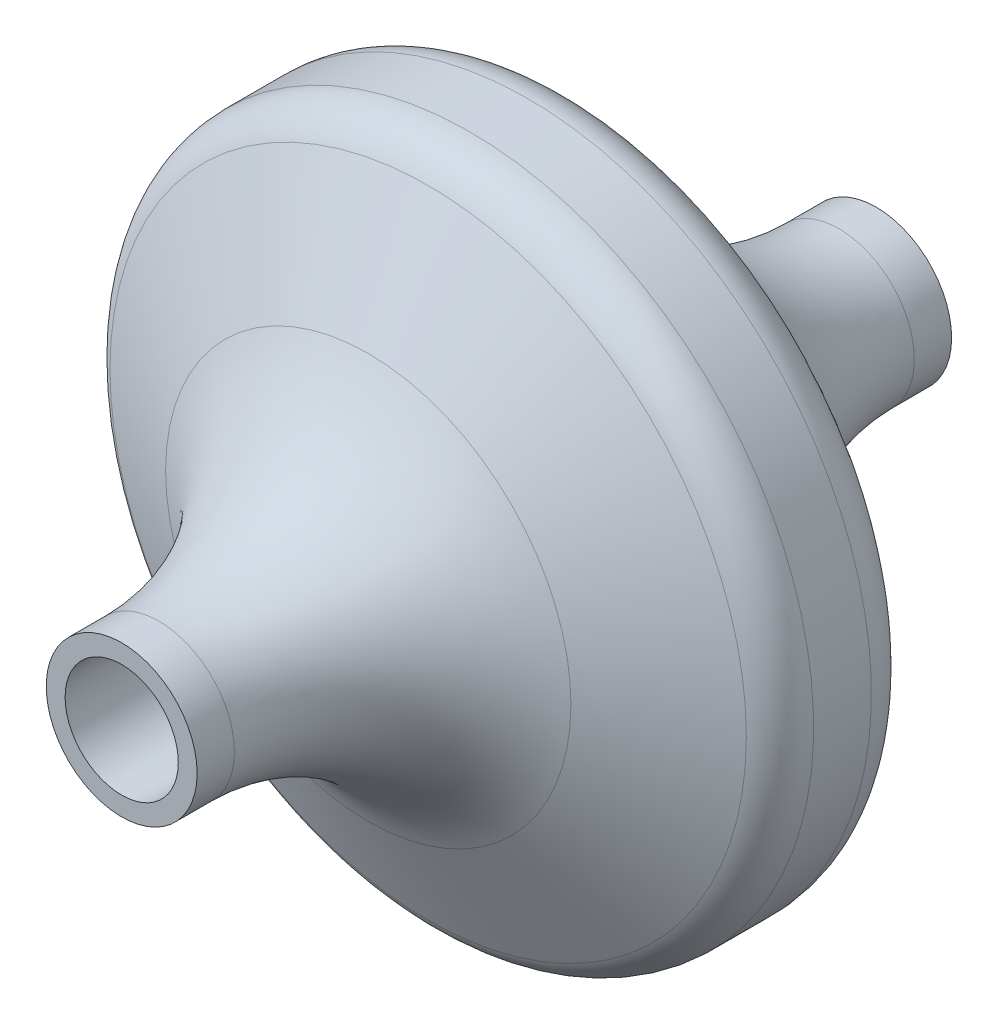
from build123d import *

# Parameters (mm, degrees)
SKETCH1_R           = 8
SKETCH1_R_2         = 6
BOSS_EXTRUDE1_DEPTH = 40
FILLET1_R           = 25


with BuildPart() as part:
    # Sketch1 → Boss-Extrude1 (new, symmetric)
    with BuildSketch(Plane.XY):
        Circle(SKETCH1_R)
        Circle(SKETCH1_R_2, mode=Mode.SUBTRACT)
    extrude(amount=BOSS_EXTRUDE1_DEPTH, both=True)

    # Sketch2 → Revolve1 (revolve)
    with BuildSketch(Plane(origin=(0, 0, 0), x_dir=(0, 0, -1), z_dir=(1, 0, 0)), mode=Mode.PRIVATE) as revolve1_sk:
        with BuildLine():
            Line((-25, 0), (-7.502982863, 33.73728427))
            ThreePointArc((-7.502982863, 33.73728427), (-5.661537285, 35.707899486), (-3.064404332, 36.4353241))
            Line((-3.064404332, 36.4353241), (3.064404332, 36.4353241))
            ThreePointArc((3.064404332, 36.4353241), (5.661537285, 35.707899486), (7.502982863, 33.73728427))
            Line((7.502982863, 33.73728427), (25, 0))
            Line((25, 0), (-25, 0))
        make_face()
    revolve(revolve1_sk.sketch.rotate(Axis((0, 0, -25), (0, 0, 1)), 90), axis=Axis((0, 0, -25), (0, 0, 1)))

    # Fillet1
    fillet1_edges = [part.edges().sort_by_distance(p)[0] for p in [
        (0, 8, -20.850995712),
        (0, 8, 20.850995712),
    ]]
    fillet(fillet1_edges, radius=FILLET1_R)


solid = part.part
